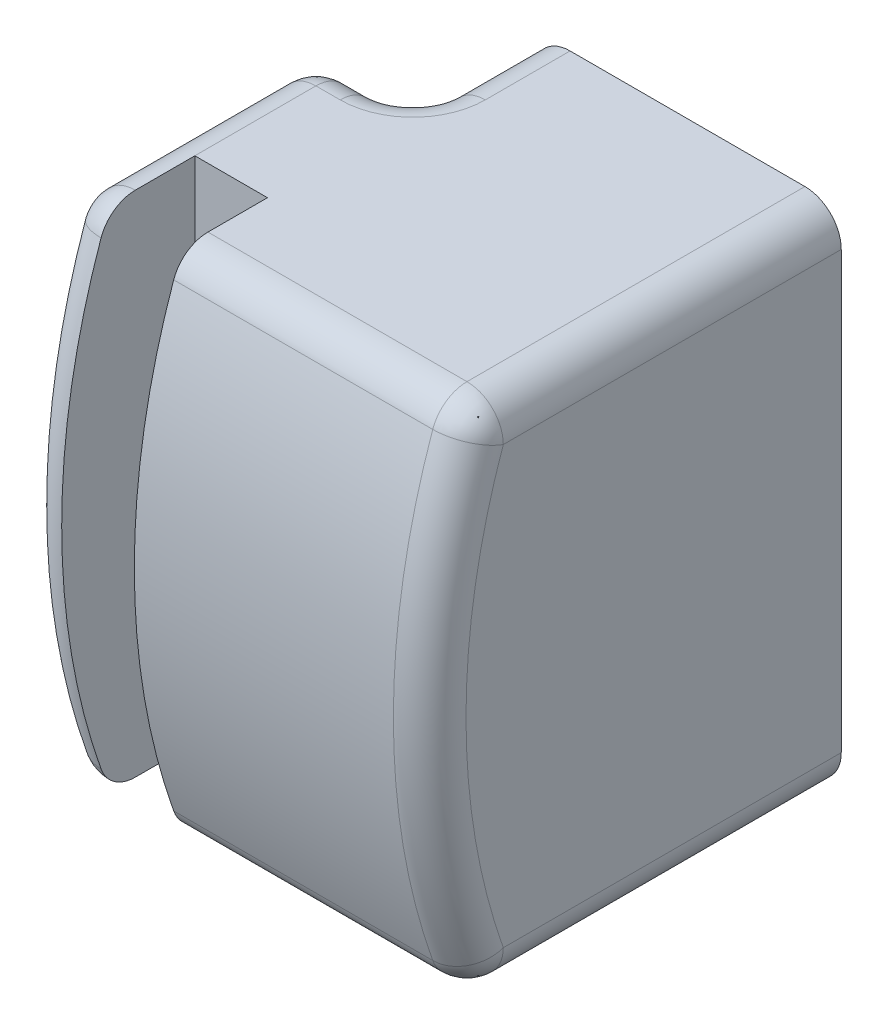
from build123d import *

# Parameters (mm, degrees)
CROQUIS1_W                 = 117
CROQUIS1_H                 = 200
SALIENTE_EXTRUIR1_DEPTH    = 5
CROQUIS2_W                 = 127
CROQUIS2_H                 = 210
CROQUIS2_W_2               = 117
CROQUIS2_H_2               = 200
SALIENTE_EXTRUIR2_DEPTH    = 150
CROQUIS3_W                 = 100
CROQUIS3_H                 = 210
SALIENTE_EXTRUIR3_DEPTH    = 40
SALIENTE_EXTRUIR4_DEPTH    = 167
REDONDEO1_R                = 15
CORTAR_EXTRUIR1_DEPTH      = 207.790352773
CORTAR_EXTRUIR1_DEPTH_BACK = 30
CROQUIS5_W                 = 30
CROQUIS5_H                 = 210
CROQUIS6_W                 = 12.5
CROQUIS6_H                 = 8.471901852
CROQUIS6_R                 = 2.5
SALIENTE_EXTRUIR6_DEPTH    = 2


with BuildPart() as part:
    # Croquis1 → Saliente-Extruir1 (new body)
    with BuildSketch(Plane.XY):
        Rectangle(CROQUIS1_W, CROQUIS1_H)
    extrude(amount=SALIENTE_EXTRUIR1_DEPTH)

    # Croquis2 → Saliente-Extruir2 (add)
    with BuildSketch(Plane.XY.offset(5)):
        Rectangle(CROQUIS2_W, CROQUIS2_H)
        Rectangle(CROQUIS2_W_2, CROQUIS2_H_2, mode=Mode.SUBTRACT)
    extrude(amount=-SALIENTE_EXTRUIR2_DEPTH)

    # Croquis3 → Saliente-Extruir3 (add)
    with BuildSketch(Plane.ZY.offset(63.5)):
        with Locations((-45, 0)):
            Rectangle(CROQUIS3_W, CROQUIS3_H)
    extrude(amount=SALIENTE_EXTRUIR3_DEPTH)

    # Croquis4 → Saliente-Extruir4 (add)
    with BuildSketch(Plane.ZY.offset(103.5)):
        with BuildLine():
            Line((5, 105), (5, -105))
            ThreePointArc((5, -105), (25, 0), (5, 105))
        make_face()
    extrude(amount=-SALIENTE_EXTRUIR4_DEPTH)

    # Redondeo1
    redondeo1_edges = [part.edges().sort_by_distance(p)[0] for p in [
        (63.5, 105, -70),
        (63.5, -105, -70),
        (-63.5, -105, -120),
        (-63.5, 105, -120),
        (-20, 105, 5),
        (-20, -105, 5),
        (-63.5, 0, -95),
        (-83.5, 105, -95),
        (-83.5, -105, -95),
        (-103.5, 105, -45),
        (-103.5, 0, -95),
        (-103.5, -105, -45),
        (-103.5, 0, 25),
        (63.5, 0, 25),
    ]]
    fillet(redondeo1_edges, radius=REDONDEO1_R)

    # Croquis5 → Cortar-Extruir1 (cut, two sides: drawn at the far end of the back side and taken through both)
    with BuildSketch(Plane.XY.offset(-CORTAR_EXTRUIR1_DEPTH_BACK)):
        with Locations((-73.5, 0)):
            Rectangle(CROQUIS5_W, CROQUIS5_H)
    extrude(amount=CORTAR_EXTRUIR1_DEPTH + CORTAR_EXTRUIR1_DEPTH_BACK, mode=Mode.SUBTRACT)

    # Croquis6 → Saliente-Extruir6 (add)
    # profile 1 of 2: a face of its own
    with BuildSketch(Plane.ZY.offset(58.5)):
        with Locations((-6.25, -40.416867006)):
            Rectangle(CROQUIS6_W, CROQUIS6_H)
        with Locations((-7.403741824, -40.5)):
            Circle(CROQUIS6_R, mode=Mode.SUBTRACT)
    # profile 2 of 2: a face of its own
    with BuildSketch(Plane.ZY.offset(58.5)):
        with Locations((-6.25, -89.583132994)):
            Rectangle(CROQUIS6_W, CROQUIS6_H)
        with Locations((-7.403741824, -89.5)):
            Circle(CROQUIS6_R, mode=Mode.SUBTRACT)
    extrude(amount=-SALIENTE_EXTRUIR6_DEPTH)


solid = part.part
